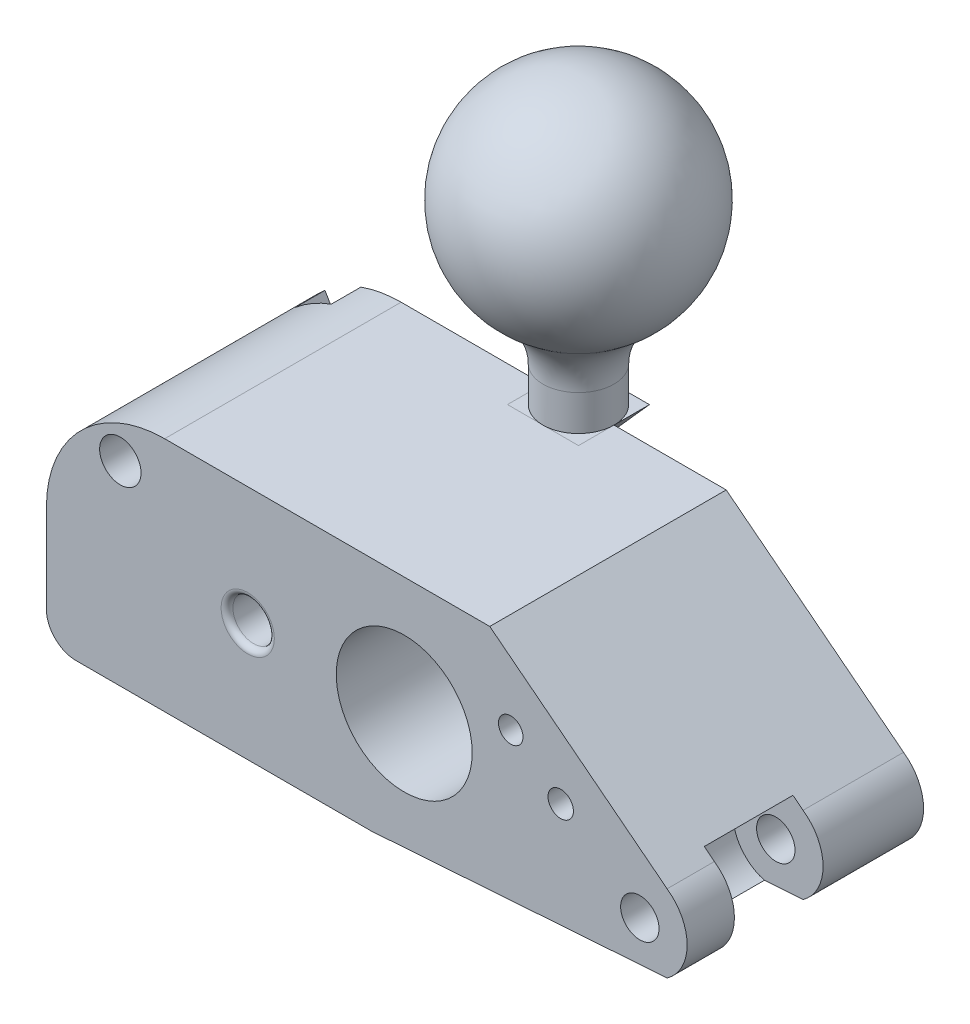
from build123d import *

# Parameters (mm, degrees)
BOSS_EXTRUDE1_DEPTH      = 40
SKETCH1_7_W              = 6
SKETCH1_7_H              = 23.17
FILLET3_R                = 11
BOSS_EXTRUDE3_DEPTH      = 6
BOSS_EXTRUDE3_DEPTH_BACK = 6
CUT_EXTRUDE2_DEPTH       = 6
SKETCH15_R               = 2.15
CUT_EXTRUDE9_DEPTH       = 14
CUT_EXTRUDE10_START      = -14
SKETCH15_5_R             = 3.5
SKETCH15_5_R_2           = 2.15
CUT_EXTRUDE10_DEPTH      = 24
FILLET8_R                = 1
SKETCH17_R               = 2.15
CUT_EXTRUDE12_DEPTH      = 57
CUT_EXTRUDE13_START      = -10
CUT_EXTRUDE13_DEPTH      = 3.7
CHAMFER1_SIZE            = 30
CHAMFER1_SIZE2           = 23.438568795
CHAMFER2_SIZE            = 50
CHAMFER2_SIZE2           = 3.496340597
SKETCH20_R               = 3.25
BOSS_EXTRUDE4_DEPTH      = 40
SKETCH20_3_R             = 3.25
CUT_EXTRUDE14_DEPTH      = 40
CUT_EXTRUDE16_START      = -8
SKETCH22_R               = 7.25
CUT_EXTRUDE16_DEPTH      = 15
CUT_EXTRUDE17_START      = -28
CUT_EXTRUDE17_DEPTH      = 4.4
CUT_EXTRUDE18_DEPTH      = 5
CUT_EXTRUDE18_DEPTH_BACK = 5
CUT_EXTRUDE18_START      = -40
CUT_EXTRUDE19_START      = -22
SKETCH24_4_R             = 3.5
CUT_EXTRUDE19_DEPTH      = 22
SKETCH24_6_R             = 2.15
CUT_EXTRUDE20_DEPTH      = 42
CUT_EXTRUDE21_START      = -40
SKETCH27_R               = 3.1
CUT_EXTRUDE21_DEPTH      = 15
SKETCH27_3_R             = 11.5
CUT_EXTRUDE22_DEPTH      = 25
SKETCH27_5_R             = 2.075
CUT_EXTRUDE23_DEPTH      = 20


with BuildPart() as part:
    # Sketch1 → Boss-Extrude1 (new body)
    with BuildSketch(Plane.XY):
        with BuildLine():
            Line((55, -30), (15.948877571, -30))
            Line((15.948877571, -30), (-0.008322998, -30))
            Line((-0.008322998, -30), (-6.008322998, -30))
            Line((-6.008322998, -30), (-15.965523568, -30))
            Line((-15.965523568, -30), (-30, -30))
            ThreePointArc((-30, -30), (-44.142135624, -35.857864376), (-50, -50))
            Line((-50, -50), (-50, -65))
            ThreePointArc((-50, -65), (-48.535533906, -68.535533906), (-45, -70))
            Line((-45, -70), (55, -70))
            Line((55, -70), (55, -30))
        make_face()
    extrude(amount=BOSS_EXTRUDE1_DEPTH)

    # Sketch4<2> → Cut-Extrude2 (cut)
    with BuildSketch(Plane(origin=(0, 0, 0), x_dir=(-1, 0, 0), z_dir=(0, 0, -1))):
        Polygon((7.447857811, -45.092522712), (7.447857811, -54.907477288), (15.947857811, -59.814954576), (24.447857811, -54.907477288), (24.447857811, -45.092522712), (15.947857811, -40.185045424), (6.008322998, -30), (-6.008322998, -30), align=None)
    extrude(amount=-CUT_EXTRUDE2_DEPTH, mode=Mode.SUBTRACT)

    # Sketch15 → Cut-Extrude9 (cut)
    with BuildSketch(Plane(origin=(0, 0, 6), x_dir=(-1, 0, 0), z_dir=(0, 0, -1))):
        with Locations((15.947857811, -50)):
            Circle(SKETCH15_R)
    extrude(amount=-CUT_EXTRUDE9_DEPTH, mode=Mode.SUBTRACT)

    # Sketch15<5> → Cut-Extrude10 (cut)
    # profile 1 of 2: a face of its own
    with BuildSketch(Plane(origin=(0, 0, 6), x_dir=(-1, 0, 0), z_dir=(0, 0, -1)).offset(CUT_EXTRUDE10_START)):
        with Locations((15.947857811, -50)):
            Circle(SKETCH15_5_R)
        with Locations((15.947857811, -50)):
            Circle(SKETCH15_5_R_2, mode=Mode.SUBTRACT)
    # profile 2 of 2: a face of its own
    with BuildSketch(Plane(origin=(0, 0, 6), x_dir=(-1, 0, 0), z_dir=(0, 0, -1)).offset(CUT_EXTRUDE10_START)):
        with Locations((15.947857811, -50)):
            Circle(SKETCH15_5_R_2)
    extrude(amount=-CUT_EXTRUDE10_DEPTH, mode=Mode.SUBTRACT)

    # Fillet8
    fillet8_edges = [part.edges().sort_by_distance(p)[0] for p in [
        (-12.447857811, -50, 40),
    ]]
    fillet(fillet8_edges, radius=FILLET8_R)

    # Sketch17 → Cut-Extrude12 (cut)
    with BuildSketch(Plane.XY.offset(40)):
        with Locations((37, -50)):
            Circle(SKETCH17_R)
    extrude(amount=-CUT_EXTRUDE12_DEPTH, mode=Mode.SUBTRACT)

    # Sketch17<4> → Cut-Extrude13 (cut)
    with BuildSketch(Plane.XY.offset(40).offset(CUT_EXTRUDE13_START)):
        Polygon((42.196152423, -50), (39.598076211, -45.5), (34.401923789, -45.5), (31.803847577, -50), (34.401923789, -54.5), (39.598076211, -54.5), align=None)
    extrude(amount=-CUT_EXTRUDE13_DEPTH, mode=Mode.SUBTRACT)

    # Chamfer1
    chamfer1_edges = [part.edges().sort_by_distance(p)[0] for p in [
        (55, -30, 20),
    ]]
    chamfer1_side = [part.faces().sort_by_distance(p)[0] for p in [
        (12.770815955, -30, 20.368309699),
    ]]
    chamfer(chamfer1_edges, length=CHAMFER1_SIZE, length2=CHAMFER1_SIZE2, reference=chamfer1_side[0])

    # Chamfer2
    chamfer2_edges = [part.edges().sort_by_distance(p)[0] for p in [
        (55, -70, 20),
    ]]
    chamfer2_side = [part.faces().sort_by_distance(p)[0] for p in [
        (5, -70, 20),
    ]]
    chamfer(chamfer2_edges, length=CHAMFER2_SIZE, length2=CHAMFER2_SIZE2, reference=chamfer2_side[0])

    # Sketch20 → Boss-Extrude4 (add)
    with BuildSketch(Plane.XY.offset(40)):
        with Locations((50.382007811, -59.971114099)):
            Circle(SKETCH20_R)
        with BuildLine():
            ThreePointArc((55, -53.438568795), (58.382007811, -59.971114099), (55, -66.503659403))
            Line((55, -66.503659403), (55, -53.438568795))
        make_face()
    extrude(amount=-BOSS_EXTRUDE4_DEPTH)

    # Sketch20<3> → Cut-Extrude14 (cut)
    with BuildSketch(Plane.XY.offset(40)):
        with Locations((50.382007811, -59.971114099)):
            Circle(SKETCH20_3_R)
    extrude(amount=-CUT_EXTRUDE14_DEPTH, mode=Mode.SUBTRACT)

    # Sketch22 → Cut-Extrude16 (cut)
    with BuildSketch(Plane.XY.offset(40).offset(CUT_EXTRUDE16_START)):
        with Locations((50.382007811, -59.971114099)):
            Circle(SKETCH22_R)
        with BuildLine():
            Line((49.123058523, -52.83125789), (67.851672672, -49.528897904))
            Line((67.851672672, -49.528897904), (67.851672672, -70.413330294))
            Line((67.851672672, -70.413330294), (49.123058523, -67.110970308))
            ThreePointArc((49.123058523, -67.110970308), (43.132007811, -59.971114099), (49.123058523, -52.83125789))
        make_face()
        Polygon((56.87719834, -59.971114099), (53.629603076, -54.346114099), (47.134412547, -54.346114099), (43.886817283, -59.971114099), (47.134412547, -65.596114099), (53.629603076, -65.596114099), align=None)
    extrude(amount=-CUT_EXTRUDE16_DEPTH, mode=Mode.SUBTRACT)

    # Sketch22<3> → Cut-Extrude17 (cut)
    with BuildSketch(Plane.XY.offset(40).offset(CUT_EXTRUDE17_START)):
        Polygon((56.87719834, -59.971114099), (53.629603076, -54.346114099), (47.134412547, -54.346114099), (43.886817283, -59.971114099), (47.134412547, -65.596114099), (53.629603076, -65.596114099), align=None)
    extrude(amount=-CUT_EXTRUDE17_DEPTH, mode=Mode.SUBTRACT)

    # Sketch24 → Cut-Extrude18 (cut, two sides: drawn at the far end of the back side and taken through both)
    with BuildSketch(Plane.XY.offset(40).offset(CUT_EXTRUDE18_START - CUT_EXTRUDE18_DEPTH_BACK)):
        with BuildLine():
            Line((-34.468911087, -35.259618943), (-36.814595421, -31.196774499))
            ThreePointArc((-36.814595421, -31.196774499), (-40, -32.679491924), (-42.876773247, -34.696774499))
            Line((-42.876773247, -34.696774499), (-40.531088913, -38.759618943))
            ThreePointArc((-40.531088913, -38.759618943), (-35.75, -40.040707856), (-34.468911087, -35.259618943))
        make_face()
    extrude(amount=CUT_EXTRUDE18_DEPTH + CUT_EXTRUDE18_DEPTH_BACK, mode=Mode.SUBTRACT)

    # Sketch24<4> → Cut-Extrude19 (cut)
    with BuildSketch(Plane.XY.offset(40).offset(CUT_EXTRUDE19_START)):
        with Locations((-37.5, -37.009618943)):
            Circle(SKETCH24_4_R)
    extrude(amount=CUT_EXTRUDE19_DEPTH, mode=Mode.SUBTRACT)

    # Sketch24<6> → Cut-Extrude20 (cut)
    with BuildSketch(Plane.XY.offset(40)):
        with Locations((-37.5, -37.009618943)):
            Circle(SKETCH24_6_R)
    extrude(amount=-CUT_EXTRUDE20_DEPTH, mode=Mode.SUBTRACT)

    # Sketch27 → Cut-Extrude21 (cut)
    with BuildSketch(Plane.XY.offset(40).offset(CUT_EXTRUDE21_START)):
        with Locations((10.526071095, -50)):
            Circle(SKETCH27_R)
    extrude(amount=CUT_EXTRUDE21_DEPTH, mode=Mode.SUBTRACT)

    # Sketch27<3> → Cut-Extrude22 (cut)
    with BuildSketch(Plane.XY.offset(40)):
        with Locations((10.526071095, -50)):
            Circle(SKETCH27_3_R)
    extrude(amount=-CUT_EXTRUDE22_DEPTH, mode=Mode.SUBTRACT)

    # Sketch27<5> → Cut-Extrude23 (cut)
    with BuildSketch(Plane.XY.offset(40)):
        with Locations((28.544110647, -43.393535189)):
            Circle(SKETCH27_5_R)
    extrude(amount=-CUT_EXTRUDE23_DEPTH, mode=Mode.SUBTRACT)


with BuildPart() as body_2:
    # Sketch1<7> → Revolve8 (revolve)
    with BuildSketch(Plane.XY, mode=Mode.PRIVATE) as revolve8_sk:
        with BuildLine():
            Line((0, 18.415), (0, -18.415))
            ThreePointArc((0, -18.415), (-18.415, 0), (0, 18.415))
        make_face()
        with Locations((-3.008322998, -18.415)):
            Rectangle(SKETCH1_7_W, SKETCH1_7_H)
    revolve(revolve8_sk.sketch.rotate(Axis((0, 18.415, 0), (0, -1, 0)), 270), axis=Axis((0, 18.415, 0), (0, -1, 0)))

    # Fillet3
    fillet3_edges = [body_2.edges().sort_by_distance(p)[0] for p in [
        (0, -17.407247908, -6.008322998),
    ]]
    fillet(fillet3_edges, radius=FILLET3_R)

    # Sketch4 → Boss-Extrude3 (add, two sides: drawn at the far end of the back side and taken through both)
    with BuildSketch(Plane(origin=(0, 0, 0), x_dir=(-1, 0, 0), z_dir=(0, 0, -1)).offset(-BOSS_EXTRUDE3_DEPTH_BACK)):
        Polygon((7.447857811, -45.092522712), (7.447857811, -54.907477288), (15.947857811, -59.814954576), (24.447857811, -54.907477288), (24.447857811, -45.092522712), (15.947857811, -40.185045424), (6.008322998, -30), (-6.008322998, -30), align=None)
    extrude(amount=BOSS_EXTRUDE3_DEPTH + BOSS_EXTRUDE3_DEPTH_BACK)


solid = Compound([part.part, body_2.part])
